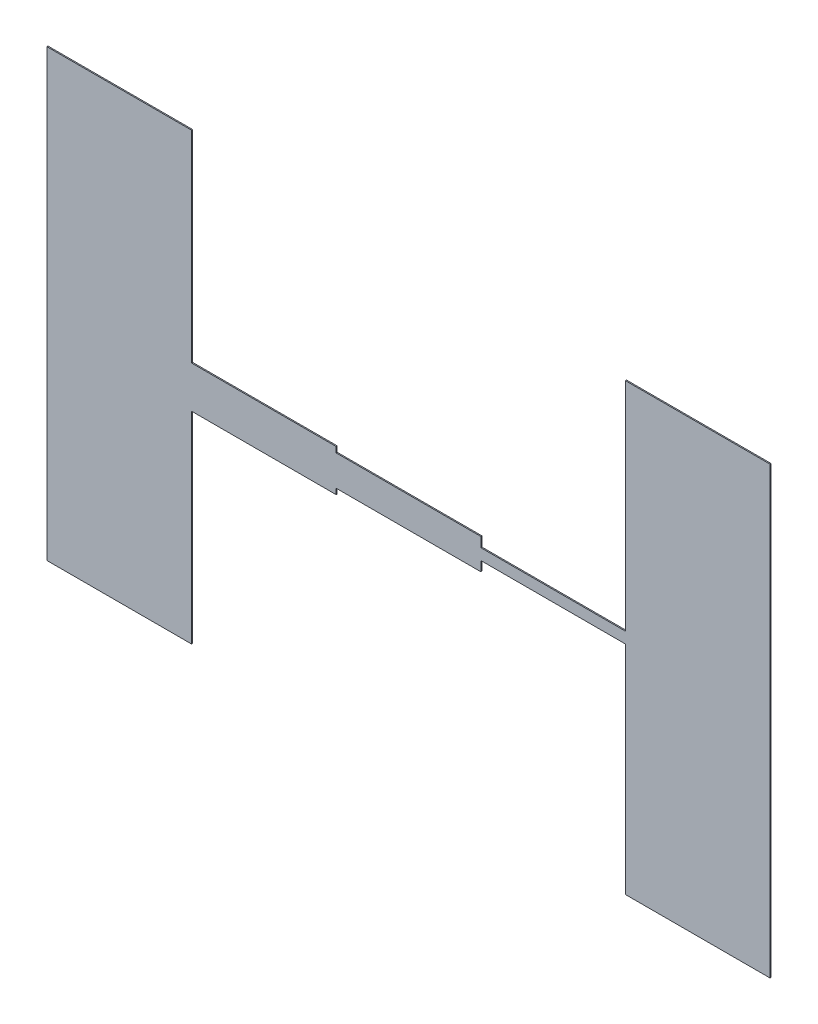
from build123d import *

# Parameters (mm, degrees)
BOSS_EXTRUDE1_DEPTH = 10


with BuildPart() as part:
    # Sketch1 → Boss-Extrude1 (new body)
    with BuildSketch(Plane.XY):
        Polygon((-650, -2000), (650, -2000), (650, -187.5), (1950, -187.5), (1950, -137.5), (3250, -137.5), (3250, -50), (4550, -50), (4550, -2000), (5850, -2000), (5850, 2000), (4550, 2000), (4550, 50), (3250, 50), (3250, 137.5), (1950, 137.5), (1950, 187.5), (650, 187.5), (650, 2000), (-650, 2000), align=None)
    extrude(amount=BOSS_EXTRUDE1_DEPTH)


solid = part.part
